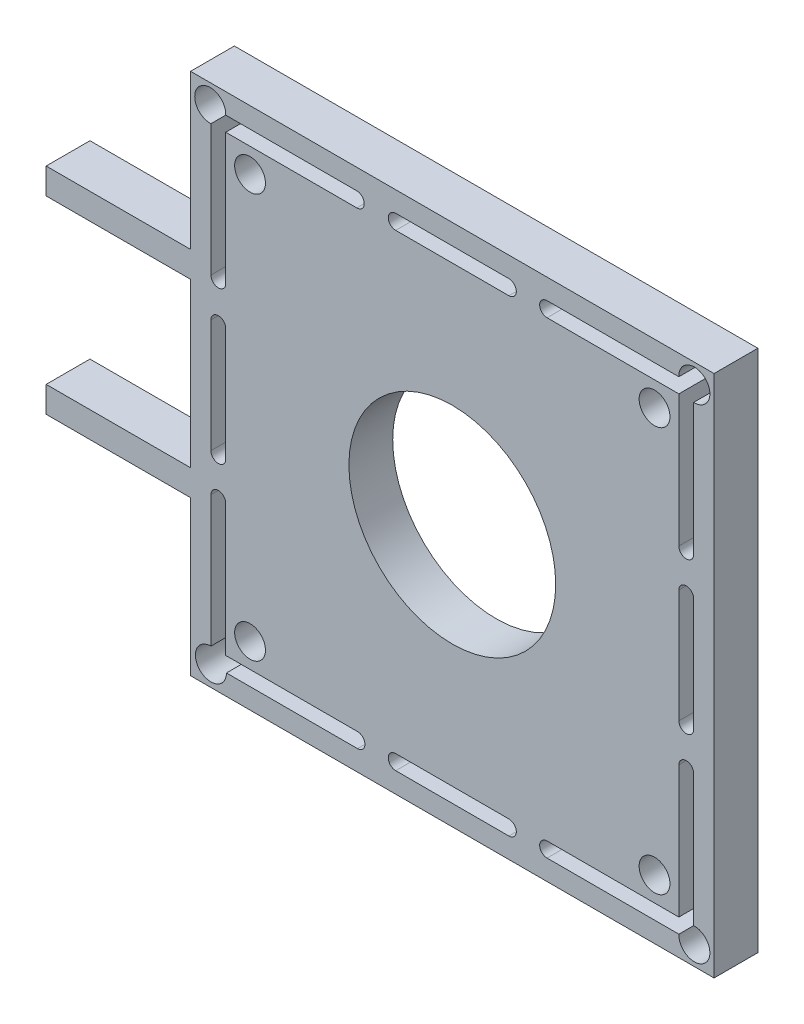
from build123d import *

# Parameters (mm, degrees)
SKETCH1_W           = 37.9349
SKETCH1_H           = 37.9349
BOSS_EXTRUDE1_DEPTH = 3.175
SKETCH9_R           = 1.1176
CUT_EXTRUDE2_DEPTH  = 3.175
SKETCH10_R          = 7.493
CUT_EXTRUDE3_DEPTH  = 3.175
SKETCH11_W          = 10.4648
SKETCH11_H          = 1.8796
BOSS_EXTRUDE2_DEPTH = 3.175


with BuildPart() as part:
    # Sketch1 → Boss-Extrude1 (new body)
    with BuildSketch(Plane.XY):
        with Locations((18.96745, 18.96745)):
            Rectangle(SKETCH1_W, SKETCH1_H)
    extrude(amount=BOSS_EXTRUDE1_DEPTH)

    # Sketch9 → Cut-Extrude2 (cut)
    with BuildSketch(Plane.XY.offset(3.175)):
        with Locations((33.62325, 33.62325)):
            Circle(SKETCH9_R)
        with Locations((4.31165, 33.62325)):
            Circle(SKETCH9_R)
        with Locations((4.31165, 4.31165)):
            Circle(SKETCH9_R)
        with Locations((33.62325, 4.31165)):
            Circle(SKETCH9_R)
        with BuildLine():
            Line((35.385619933, 12.100169933), (35.385619933, 2.549280067))
            Line((35.385619933, 2.549280067), (25.834730067, 2.549280067))
            ThreePointArc((25.834730067, 2.549280067), (25.2984, 2.01295), (25.834730067, 1.476619933))
            Line((25.834730067, 1.476619933), (35.385619933, 1.476619933))
            ThreePointArc((35.385619933, 1.476619933), (37.303202335, 0.631697665), (36.458280067, 2.549280067))
            Line((36.458280067, 2.549280067), (36.458280067, 12.100169933))
            ThreePointArc((36.458280067, 12.100169933), (35.92195, 12.6365), (35.385619933, 12.100169933))
        make_face()
        with BuildLine():
            Line((35.385619933, 36.458280067), (25.834730067, 36.458280067))
            ThreePointArc((25.834730067, 36.458280067), (25.2984, 35.92195), (25.834730067, 35.385619933))
            Line((25.834730067, 35.385619933), (35.385619933, 35.385619933))
            Line((35.385619933, 35.385619933), (35.385619933, 25.834730067))
            ThreePointArc((35.385619933, 25.834730067), (35.92195, 25.2984), (36.458280067, 25.834730067))
            Line((36.458280067, 25.834730067), (36.458280067, 35.385619933))
            ThreePointArc((36.458280067, 35.385619933), (37.303202335, 37.303202335), (35.385619933, 36.458280067))
        make_face()
        with BuildLine():
            Line((12.048880067, 36.458280067), (2.549280067, 36.458280067))
            ThreePointArc((2.549280067, 36.458280067), (0.631697665, 37.303202335), (1.476619933, 35.385619933))
            Line((1.476619933, 35.385619933), (1.476619933, 25.886019933))
            ThreePointArc((1.476619933, 25.886019933), (2.01295, 25.349689867), (2.549280067, 25.886019933))
            Line((2.549280067, 25.886019933), (2.549280067, 35.385619933))
            Line((2.549280067, 35.385619933), (12.048880067, 35.385619933))
            ThreePointArc((12.048880067, 35.385619933), (12.585210133, 35.92195), (12.048880067, 36.458280067))
        make_face()
        with BuildLine():
            Line((23.06955, 36.458280067), (14.86535, 36.458280067))
            ThreePointArc((14.86535, 36.458280067), (14.329019933, 35.92195), (14.86535, 35.385619933))
            Line((14.86535, 35.385619933), (23.06955, 35.385619933))
            ThreePointArc((23.06955, 35.385619933), (23.605880067, 35.92195), (23.06955, 36.458280067))
        make_face()
        with BuildLine():
            Line((2.549280067, 23.06955), (2.549280067, 14.86535))
            ThreePointArc((2.549280067, 14.86535), (2.01295, 14.329019933), (1.476619933, 14.86535))
            Line((1.476619933, 14.86535), (1.476619933, 23.06955))
            ThreePointArc((1.476619933, 23.06955), (2.01295, 23.605880067), (2.549280067, 23.06955))
        make_face()
        with BuildLine():
            Line((36.458280067, 23.06955), (36.458280067, 14.86535))
            ThreePointArc((36.458280067, 14.86535), (35.92195, 14.329019933), (35.385619933, 14.86535))
            Line((35.385619933, 14.86535), (35.385619933, 23.06955))
            ThreePointArc((35.385619933, 23.06955), (35.92195, 23.605880067), (36.458280067, 23.06955))
        make_face()
        with BuildLine():
            Line((23.06955, 2.549280067), (14.86535, 2.549280067))
            ThreePointArc((14.86535, 2.549280067), (14.329019933, 2.01295), (14.86535, 1.476619933))
            Line((14.86535, 1.476619933), (23.06955, 1.476619933))
            ThreePointArc((23.06955, 1.476619933), (23.605880067, 2.01295), (23.06955, 2.549280067))
        make_face()
        with BuildLine():
            Line((2.549280067, 12.100169933), (2.549280067, 2.549280067))
            Line((2.549280067, 2.549280067), (12.100169933, 2.549280067))
            ThreePointArc((12.100169933, 2.549280067), (12.6365, 2.01295), (12.100169933, 1.476619933))
            Line((12.100169933, 1.476619933), (2.600569933, 1.476619933))
            ThreePointArc((2.600569933, 1.476619933), (0.681867267, 0.681867267), (1.476619933, 2.600569933))
            Line((1.476619933, 2.600569933), (1.476619933, 12.100169933))
            ThreePointArc((1.476619933, 12.100169933), (2.01295, 12.6365), (2.549280067, 12.100169933))
        make_face()
    extrude(amount=-CUT_EXTRUDE2_DEPTH, mode=Mode.SUBTRACT)

    # Sketch10 → Cut-Extrude3 (cut)
    with BuildSketch(Plane(origin=(0, 0, 0), x_dir=(-1, 0, 0), z_dir=(0, 0, -1))):
        with Locations((-18.96745, 18.96745)):
            Circle(SKETCH10_R)
    extrude(amount=-CUT_EXTRUDE3_DEPTH, mode=Mode.SUBTRACT)

    # Sketch11 → Boss-Extrude2 (add)
    with BuildSketch(Plane.XY.offset(3.175)):
        with Locations((-5.2324, 25.8191)):
            Rectangle(SKETCH11_W, SKETCH11_H)
        with Locations((-5.2324, 12.1158)):
            Rectangle(SKETCH11_W, SKETCH11_H)
    extrude(amount=-BOSS_EXTRUDE2_DEPTH)


solid = part.part
